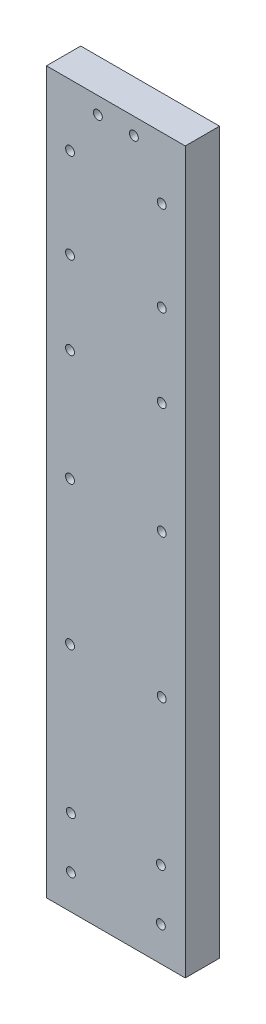
from build123d import *

# Parameters (mm, degrees)
SKETCH1_W           = 16.2
SKETCH1_H           = 84.09
SKETCH1_R           = 0.519960121
BOSS_EXTRUDE1_DEPTH = 4


with BuildPart() as part:
    # Sketch1 → Boss-Extrude1 (new body)
    with BuildSketch(Plane.XY):
        with Locations((8.1, 42.045)):
            Rectangle(SKETCH1_W, SKETCH1_H)
        with Locations((13.45, 43.74)):
            Circle(SKETCH1_R, mode=Mode.SUBTRACT)
        with Locations((2.75, 66.385)):
            Circle(SKETCH1_R, mode=Mode.SUBTRACT)
        with Locations((13.45, 56.74)):
            Circle(SKETCH1_R, mode=Mode.SUBTRACT)
        with Locations((13.45, 76.885)):
            Circle(SKETCH1_R, mode=Mode.SUBTRACT)
        with Locations((2.75, 27)):
            Circle(SKETCH1_R, mode=Mode.SUBTRACT)
        with Locations((2.75, 76.885)):
            Circle(SKETCH1_R, mode=Mode.SUBTRACT)
        with Locations((2.75, 56.74)):
            Circle(SKETCH1_R, mode=Mode.SUBTRACT)
        with Locations((2.85, 10)):
            Circle(SKETCH1_R, mode=Mode.SUBTRACT)
        with Locations(Location((13.35, 10, 0), (0, 0, 180))):
            Circle(SKETCH1_R, mode=Mode.SUBTRACT)
        with Locations(Location((13.35, 4, 0), (0, 0, 180))):
            Circle(SKETCH1_R, mode=Mode.SUBTRACT)
        with Locations((2.85, 4)):
            Circle(SKETCH1_R, mode=Mode.SUBTRACT)
        with Locations((6, 82.135)):
            Circle(SKETCH1_R, mode=Mode.SUBTRACT)
        with Locations((13.45, 27)):
            Circle(SKETCH1_R, mode=Mode.SUBTRACT)
        with Locations((13.45, 66.385)):
            Circle(SKETCH1_R, mode=Mode.SUBTRACT)
        with Locations((10.2, 82.135)):
            Circle(SKETCH1_R, mode=Mode.SUBTRACT)
        with Locations((2.75, 43.74)):
            Circle(SKETCH1_R, mode=Mode.SUBTRACT)
    extrude(amount=BOSS_EXTRUDE1_DEPTH)


solid = part.part
